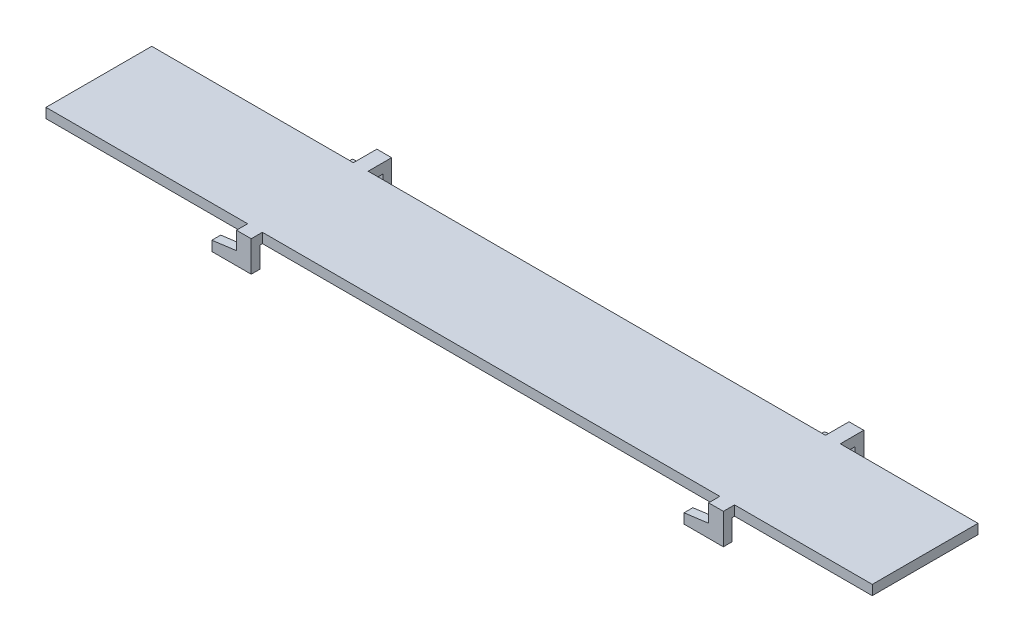
from build123d import *

# Parameters (mm, degrees)
THICKNESS_EXTRUDE_DEPTH = 2
HOOK_1_EXTRUDE_DEPTH    = 0.9
HOOK_START              = -26.75
HOOK_2_EXTRUDE_DEPTH    = 0.9
HOOK_PATTERN_COUNT      = 2
HOOK_PATTERN_PITCH      = 96


with BuildPart() as part:
    # Top Sketch → Thickness Extrude (new body)
    with BuildSketch(Plane(origin=(0, 0, 0), x_dir=(1, 0, 0), z_dir=(0, 1, 0))):
        Polygon((-28, -21.5), (-28, -22.875), (-31, -22.875), (-31, -21.5), (-124, -21.5), (-124, -22.875), (-127, -22.875), (-127, -21.5), (-168, -21.5), (-168, 0), (-127, 0), (-127, 3.875), (-124, 3.875), (-124, 0), (-31, 0), (-31, 3.875), (-28, 3.875), (-28, 0), (0, 0), (0, -21.5), align=None)
    extrude(amount=THICKNESS_EXTRUDE_DEPTH)


with BuildPart() as body_2:
    # Hook Sketch → Hook 1 Extrude (new, symmetric)
    with BuildSketch(Plane.XY.offset(22.875)):
        Polygon((-31, 2), (-28, 2), (-28, -4.258262488), (-36, -4.258262488), (-36, -2.258262488), (-31, -1.6), align=None)
    hook_1_extrude = extrude(amount=HOOK_1_EXTRUDE_DEPTH, both=True)


with BuildPart() as body_3:
    # Hook Sketch<2> → Hook 2 Extrude (new, symmetric)
    with BuildSketch(Plane.XY.offset(22.875).offset(HOOK_START)):
        Polygon((-31, 2), (-28, 2), (-28, -4.258262488), (-36, -4.258262488), (-36, -2.258262488), (-31, -1.6), align=None)
    hook_2_extrude = extrude(amount=HOOK_2_EXTRUDE_DEPTH, both=True)


with BuildPart() as hook_pattern_1:
    # Hook Pattern: pattern copy
    add(hook_1_extrude.moved(Location(Vector(-1, 0, 0) * (1 * HOOK_PATTERN_PITCH))))


with BuildPart() as hook_pattern_2:
    # Hook Pattern: pattern copy
    add(hook_2_extrude.moved(Location(Vector(-1, 0, 0) * (1 * HOOK_PATTERN_PITCH))))


with BuildPart() as part_1:
    add(part.part)

    # Combine Bodies: union body 2, body 3, Hook Pattern_1, Hook Pattern_2
    add(body_2.part)
    add(body_3.part)
    add(hook_pattern_1.part)
    add(hook_pattern_2.part)


solid = part_1.part
